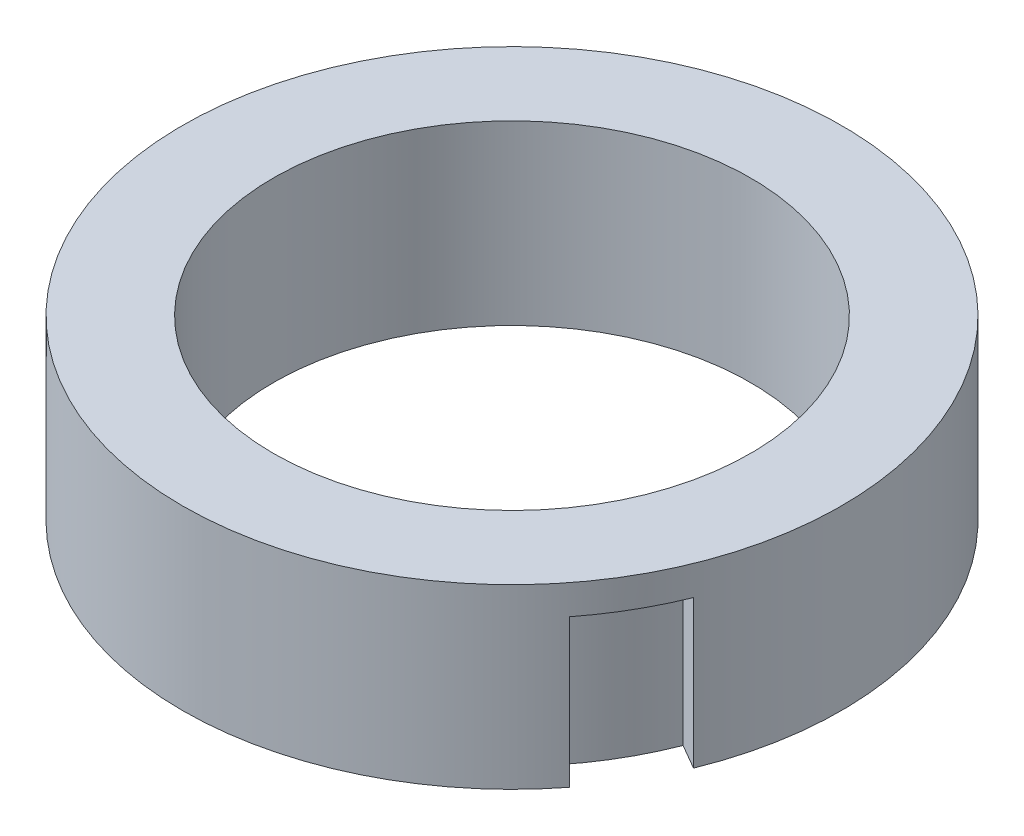
from build123d import *

# Parameters (mm, degrees)
SKETCH1_R           = 10.5
BOSS_EXTRUDE1_DEPTH = 6.5
BOSS_EXTRUDE2_START = 1.3
SKETCH1_3_R         = 14.5
SKETCH1_3_R_2       = 10.5
BOSS_EXTRUDE2_DEPTH = 1.3


with BuildPart() as part:
    # Sketch1 → Boss-Extrude1 (new body)
    with BuildSketch(Plane(origin=(0, 0, 0), x_dir=(1, 0, 0), z_dir=(0, 1, 0))):
        with BuildLine():
            Line((-13.437342964, -5.448652501), (-12.343362597, -4.817042641))
            ThreePointArc((-12.343362597, -4.817042641), (-11.4748366, -6.625), (-10.343362597, -8.281144256))
            Line((-10.343362597, -8.281144256), (-11.437342964, -8.912754116))
            ThreePointArc((-11.437342964, -8.912754116), (0, -14.5), (11.437342964, -8.912754116))
            Line((11.437342964, -8.912754116), (10.343362597, -8.281144256))
            ThreePointArc((10.343362597, -8.281144256), (11.4748366, -6.625), (12.343362597, -4.817042641))
            Line((12.343362597, -4.817042641), (13.437342964, -5.448652501))
            ThreePointArc((13.437342964, -5.448652501), (12.557368355, 7.25), (2, 14.361406616))
            Line((2, 14.361406616), (2, 13.098186897))
            ThreePointArc((2, 13.098186897), (0, 13.25), (-2, 13.098186897))
            Line((-2, 13.098186897), (-2, 14.361406616))
            ThreePointArc((-2, 14.361406616), (-12.557368355, 7.25), (-13.437342964, -5.448652501))
        make_face()
        Circle(SKETCH1_R, mode=Mode.SUBTRACT)
    extrude(amount=-BOSS_EXTRUDE1_DEPTH)

    # Sketch1<3> → Boss-Extrude2 (add)
    with BuildSketch(Plane(origin=(0, 0, 0), x_dir=(1, 0, 0), z_dir=(0, 1, 0)).offset(BOSS_EXTRUDE2_START)):
        Circle(SKETCH1_3_R)
        Circle(SKETCH1_3_R_2, mode=Mode.SUBTRACT)
    extrude(amount=-BOSS_EXTRUDE2_DEPTH)


solid = part.part
